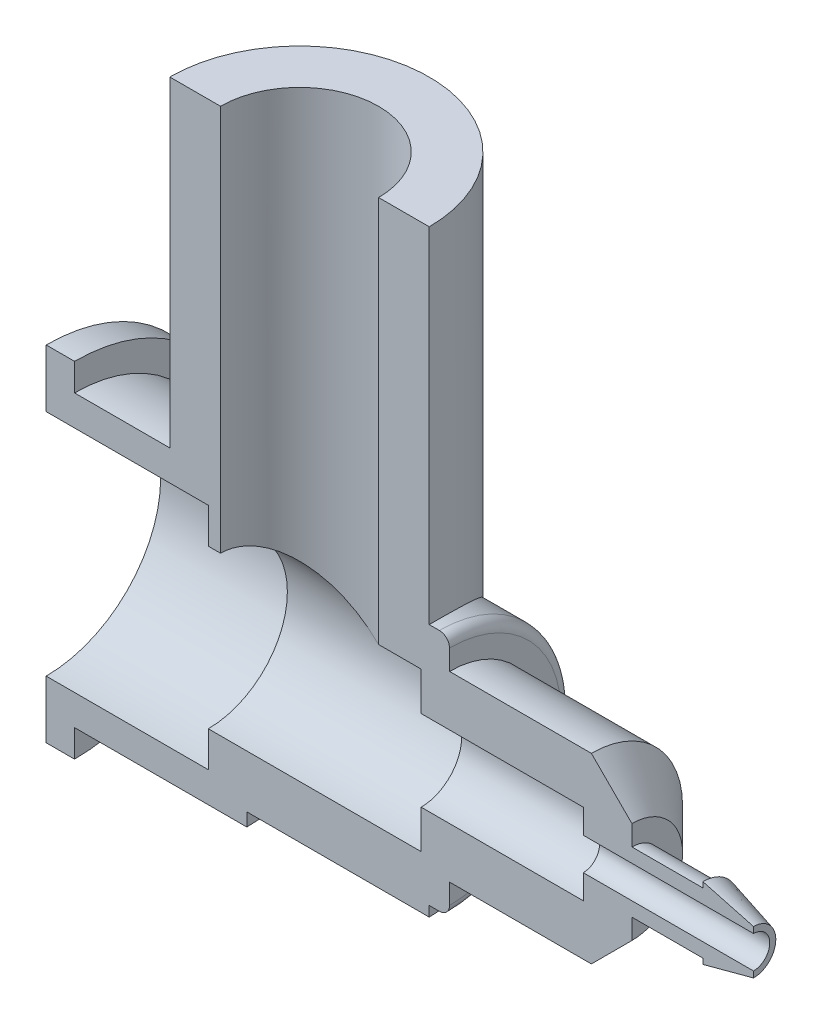
from build123d import *

# Parameters (mm, degrees)
CONG_1_R                = 0.5
ENL_V_START             = -23
ESQUISSE9_R             = 3.9
ENL_V_MAT_EXTRU_4_DEPTH = 23
ESQUISSE10_W            = 39.610149942
ESQUISSE10_H            = 38.899653979
ENL_V_MAT_EXTRU_5_DEPTH = 43.652784254


with BuildPart() as part:
    # Esquisse1 → Base-Révolution (revolve)
    with BuildSketch(Plane.XY, mode=Mode.PRIVATE) as base_r_volution_sk:
        Polygon((0, 0), (0, 8.5), (1.4, 8.5), (1.4, 7.15), (9.9, 7.15), (9.9, 6), (19.9, 6), (19.9, 4.5), (26.9, 4.5), (28.9, 2.5), (28.9, 1.5), (32.4, 1.5), (32.4, 1.769872981), (34.9, 1.1), (34.9, 0), align=None)
    revolve(base_r_volution_sk.sketch.rotate(Axis((0, 0, 0), (1, 0, 0)), 90), axis=Axis((0, 0, 0), (1, 0, 0)))

    # Esquisse2 → Boss.-Révol.1 (revolve)
    with BuildSketch(Plane.XY):
        Polygon((8.6, 23), (8.6, -4), (12.5, -4), (12.5, -6.5), (6.1, -6.5), (6.1, 23), align=None)
    revolve(axis=Axis((12.5, 24, 0), (0, -1, 0)))

    # Esquisse7 → Enlèvement de matière-Révolution1 (revolve, cut)
    with BuildSketch(Plane.XY, mode=Mode.PRIVATE) as enl_vement_de_mati_re_r_volution1_sk:
        Polygon((34.9, 0.8), (34.9, 0), (0, 0), (0, 5.65), (8, 5.65), (8, 3.9), (18.5, 3.9), (18.5, 2), (26.5, 2), (26.5, 0.8), align=None)
    revolve(enl_vement_de_mati_re_r_volution1_sk.sketch.rotate(Axis((36, 0, 0), (-1, 0, 0)), 90), axis=Axis((36, 0, 0), (-1, 0, 0)), mode=Mode.SUBTRACT)

    # Congé1
    cong_1_edges = [part.edges().sort_by_distance(p)[0] for p in [
        (19.9, 0, -6),
        (9.9, -2.157400318, 6.816753177),
    ]]
    fillet(cong_1_edges, radius=CONG_1_R)

    # Esquisse9 → Enlèv. mat.-Extru.4 (cut)
    with BuildSketch(Plane(origin=(0, 23, 0), x_dir=(-1, 0, 0), z_dir=(0, 1, 0)).offset(ENL_V_START)):
        with Locations((-12.5, 0)):
            Circle(ESQUISSE9_R)
    extrude(amount=ENL_V_MAT_EXTRU_4_DEPTH, mode=Mode.SUBTRACT)

    # Esquisse10 → Enlèv. mat.-Extru.5 (cut, through all)
    with BuildSketch(Plane.XY):
        with Locations((16.621088043, 7.131584007)):
            Rectangle(ESQUISSE10_W, ESQUISSE10_H)
    extrude(amount=ENL_V_MAT_EXTRU_5_DEPTH, mode=Mode.SUBTRACT)


solid = part.part
